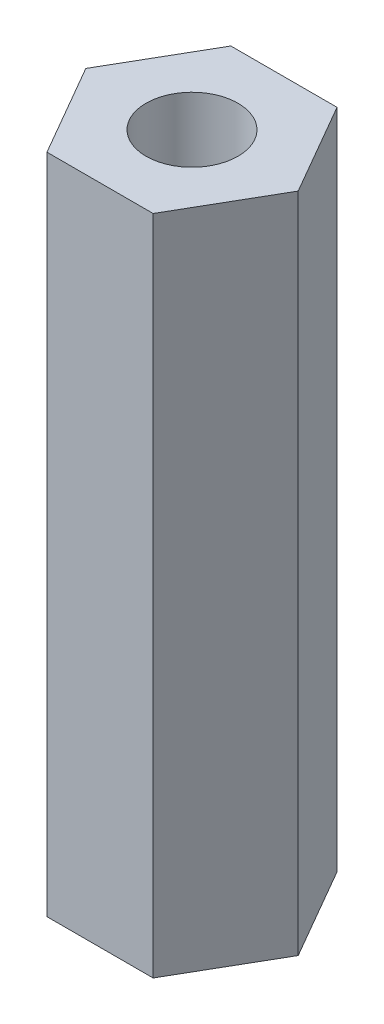
from build123d import *

# Parameters (mm, degrees)
SKETCH_1_R      = 1.25
EXTRUDE_1_DEPTH = 18


with BuildPart() as part:
    # 草图1 → 凸台-拉伸1 (new body)
    with BuildSketch(Plane(origin=(0, 0, 0), x_dir=(1, 0, 0), z_dir=(0, 1, 0))):
        Polygon((1.443375673, -2.5), (2.886751346, 0), (1.443375673, 2.5), (-1.443375673, 2.5), (-2.886751346, 0), (-1.443375673, -2.5), align=None)
        with Locations(Location((0, 0, 0), (0, 0, 270))):
            Circle(SKETCH_1_R, mode=Mode.SUBTRACT)
    extrude(amount=EXTRUDE_1_DEPTH)


solid = part.part
